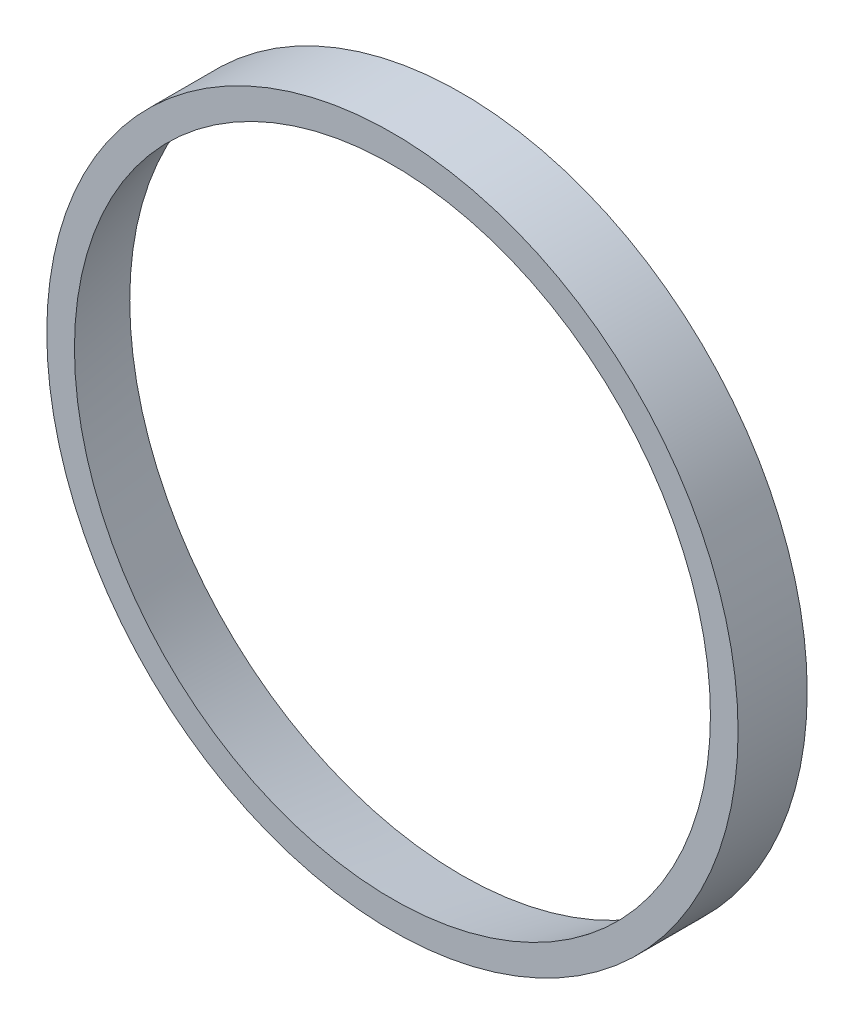
from build123d import *


with BuildPart() as part:
    # Sketch1 → Revolve1 (revolve)
    with BuildSketch(Plane(origin=(0, 0, 0), x_dir=(1, 0, 0), z_dir=(0, 1, 0))):
        Polygon((15.875, 0), (15.875, 3.175), (15.24, 3.175), (14.605, 0), align=None)
    revolve(axis=Axis((0, 0, 0), (0, 0, -1)))


solid = part.part
